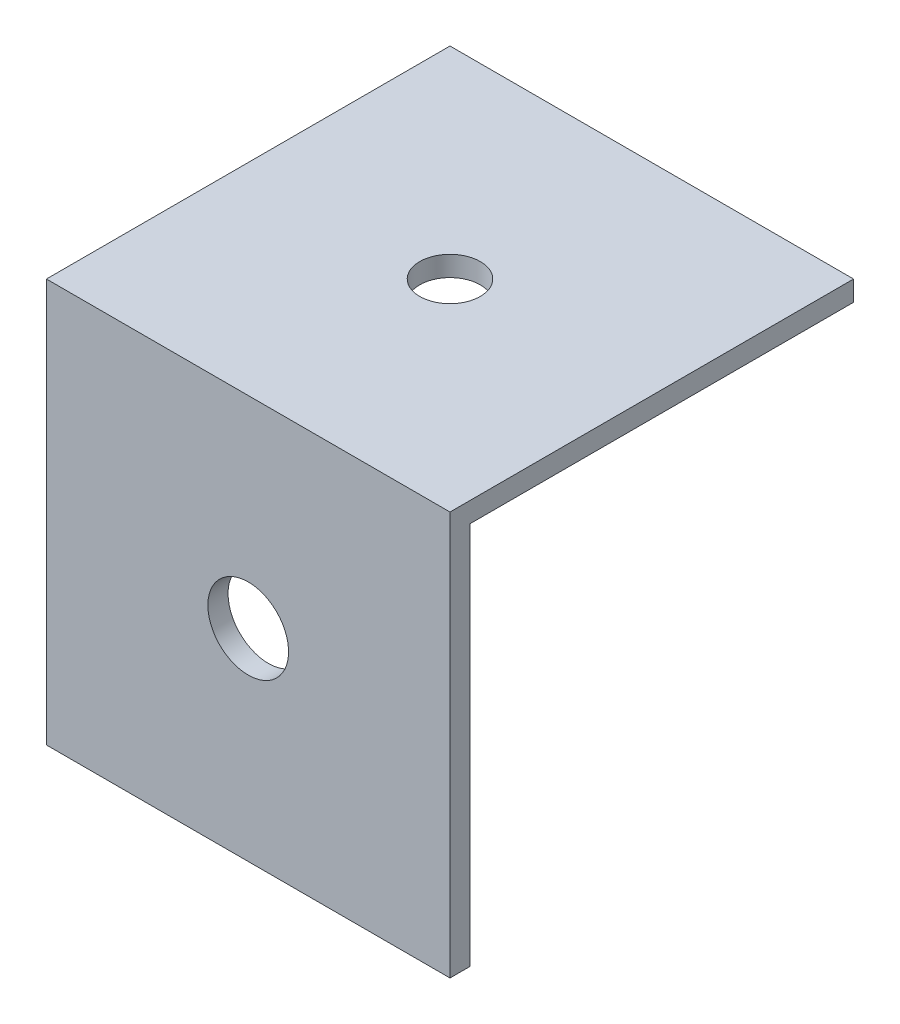
from build123d import *

# Parameters (mm, degrees)
EXTRUDE_1_DEPTH     = 20
SKETCH_2_R          = 2
CUT_EXTRUDE_1_DEPTH = 35.073450075
SKETCH_3_R          = 1.5
CUT_EXTRUDE_2_DEPTH = 35.073450075


with BuildPart() as part:
    # 草图1 → 凸台-拉伸1 (new body)
    with BuildSketch(Plane(origin=(0, 0, 0), x_dir=(0, 0, -1), z_dir=(1, 0, 0))):
        Polygon((0, 0), (0, 20), (20, 20), (20, 19), (1, 19), (1, 0), align=None)
    extrude(amount=EXTRUDE_1_DEPTH)

    # 草图2 → 切除-拉伸1 (cut, through all)
    with BuildSketch(Plane(origin=(0, 0, -1), x_dir=(-1, 0, 0), z_dir=(0, 0, -1))):
        with Locations((-10, 10)):
            Circle(SKETCH_2_R)
    extrude(amount=-CUT_EXTRUDE_1_DEPTH, mode=Mode.SUBTRACT)

    # 草图3 → 切除-拉伸2 (cut, through all)
    with BuildSketch(Plane.XZ.offset(-19)):
        with Locations(Location((10, -10, 0), (0, 0, 270))):
            Circle(SKETCH_3_R)
    extrude(amount=-CUT_EXTRUDE_2_DEPTH, mode=Mode.SUBTRACT)


solid = part.part
